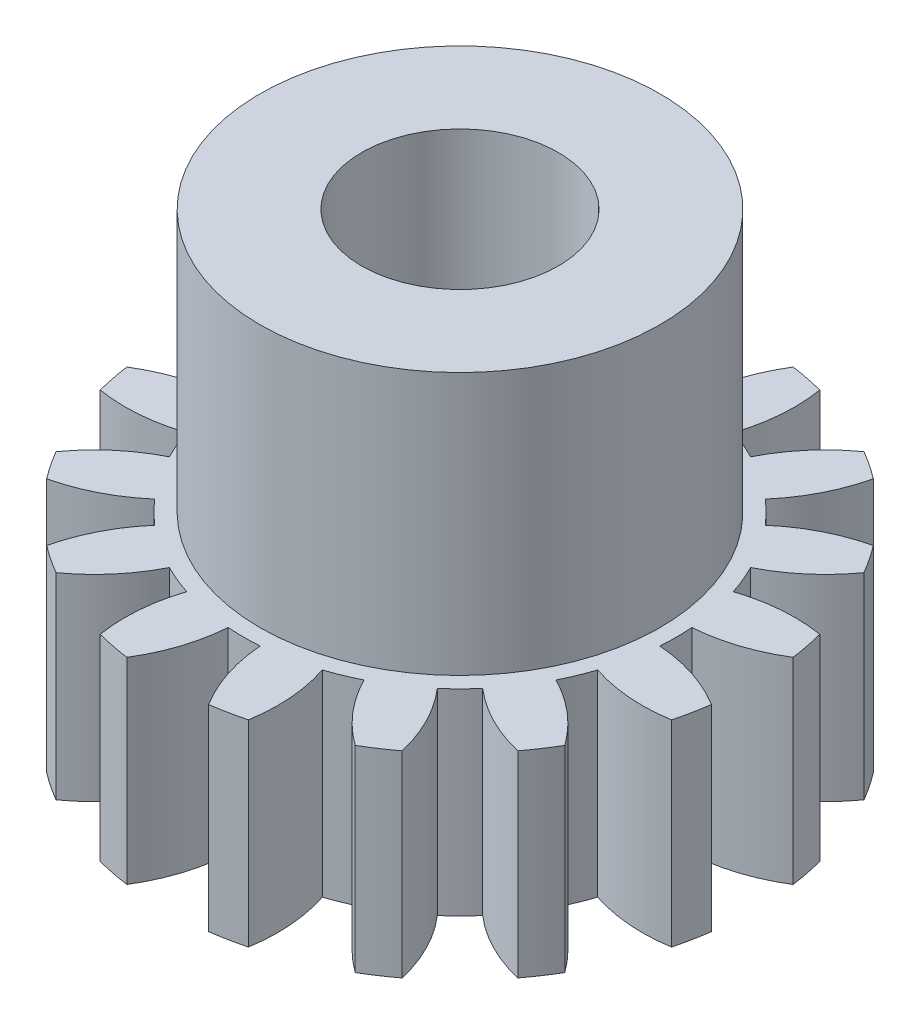
from build123d import *

# Parameters (mm, degrees)
SKETCH1_R               = 4.5
SKETCH1_R_2             = 4
SKETCH1_R_3             = 3.3
BOSS_EXTRUDE1_DEPTH     = 1.5
CUT_EXTRUDE1_DEPTH      = 7.538348415
CIRPATTERN1_COUNT       = 16
CUT_EXTRUDE2_DEPTH      = 7.478682276
CUT_EXTRUDE2_DEPTH_BACK = 7.478682276
SKETCH4_R               = 1.5
SKETCH5_R               = 3.05
SKETCH5_R_2             = 1.5
BOSS_EXTRUDE2_DEPTH     = 4


with BuildPart() as part:
    # Sketch1 → Boss-Extrude1 (new, symmetric)
    # profile 1 of 3: a face of its own
    with BuildSketch(Plane(origin=(0, 0, 0), x_dir=(1, 0, 0), z_dir=(0, 1, 0))):
        with Locations(Location((0, 0, 0), (0, 0, 270))):
            Circle(SKETCH1_R)
        Circle(SKETCH1_R_2, mode=Mode.SUBTRACT)
    # profile 2 of 3: a face of its own
    with BuildSketch(Plane(origin=(0, 0, 0), x_dir=(1, 0, 0), z_dir=(0, 1, 0))):
        Circle(SKETCH1_R_2)
        Circle(SKETCH1_R_3, mode=Mode.SUBTRACT)
    # profile 3 of 3: a face of its own
    with BuildSketch(Plane(origin=(0, 0, 0), x_dir=(1, 0, 0), z_dir=(0, 1, 0))):
        Circle(SKETCH1_R_3)
    extrude(amount=BOSS_EXTRUDE1_DEPTH, both=True)

    # Sketch3 → Cut-Extrude1 (cut, symmetric)
    with BuildSketch(Plane(origin=(0, 0, 0), x_dir=(1, 0, 0), z_dir=(0, 1, 0))):
        with BuildLine():
            ThreePointArc((-1.819764324, 5.475523519), (-0.723130395, 4.605944889), (-0.243947252, 3.290970942))
            ThreePointArc((-0.243947252, 3.290970942), (0, 3.3), (0.243947252, 3.290970942))
            ThreePointArc((0.243947252, 3.290970942), (0.723130395, 4.605944889), (1.819764324, 5.475523519))
            ThreePointArc((1.819764324, 5.475523519), (0, 5.77), (-1.819764324, 5.475523519))
        make_face()
    cut_extrude1 = extrude(amount=CUT_EXTRUDE1_DEPTH, both=True, mode=Mode.SUBTRACT)

    # CirPattern1: Cut-Extrude1 ×16 about axis
    cirpattern1_axis = Axis((0, 0, 0), (0, 1, 0))
    for i in range(1, CIRPATTERN1_COUNT):
        add(cut_extrude1.rotate(cirpattern1_axis, i * 360 / CIRPATTERN1_COUNT), mode=Mode.SUBTRACT)

    # Sketch4 → Cut-Extrude2 (cut, two sides: drawn at the far end of the back side and taken through both)
    with BuildSketch(Plane(origin=(0, 0, 0), x_dir=(1, 0, 0), z_dir=(0, 1, 0)).offset(-CUT_EXTRUDE2_DEPTH_BACK)):
        with Locations(Location((0, 0, 0), (0, 0, 270))):
            Circle(SKETCH4_R)
    extrude(amount=CUT_EXTRUDE2_DEPTH + CUT_EXTRUDE2_DEPTH_BACK, mode=Mode.SUBTRACT)

    # Sketch5 → Boss-Extrude2 (add)
    with BuildSketch(Plane(origin=(0, 1.5, 0), x_dir=(1, 0, 0), z_dir=(0, 1, 0))):
        with Locations(Location((0, 0, 0), (0, 0, 270))):
            Circle(SKETCH5_R)
        with Locations(Location((0, 0, 0), (0, 0, 270))):
            Circle(SKETCH5_R_2, mode=Mode.SUBTRACT)
    extrude(amount=BOSS_EXTRUDE2_DEPTH)


solid = part.part
